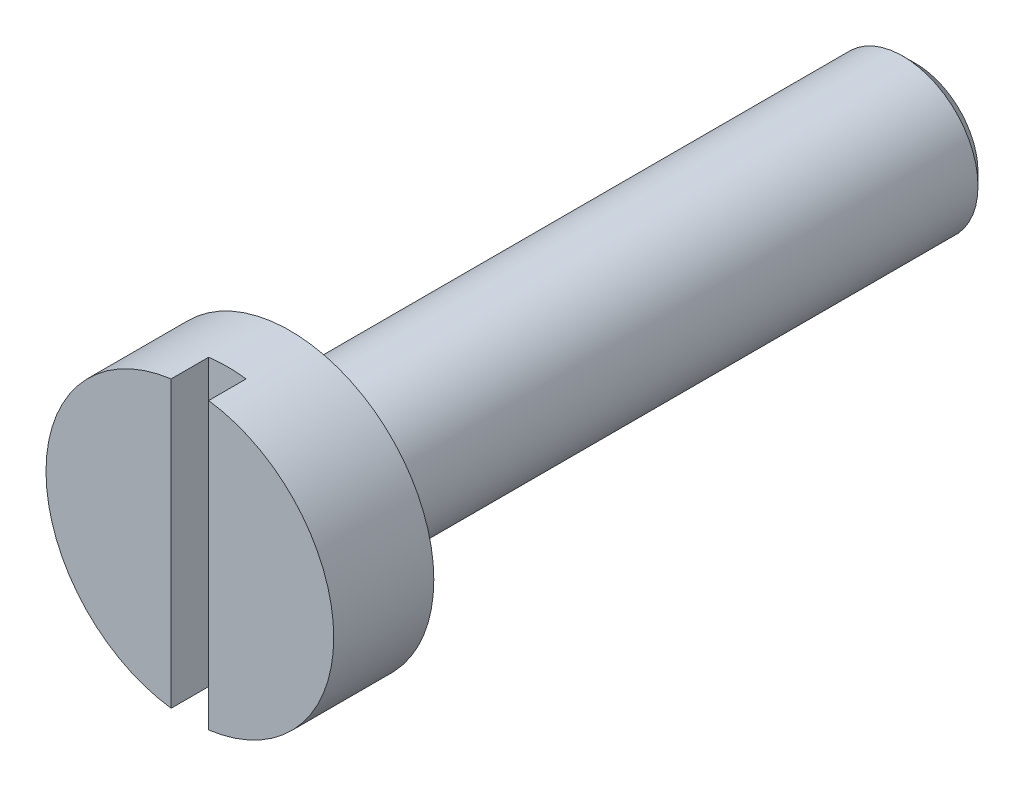
from build123d import *

# Parameters (mm, degrees)
SKETCH_1_R          = 1.15
EXTRUDE_1_DEPTH     = 0.8
SKETCH_2_R          = 0.6
EXTRUDE_2_DEPTH     = 5
CHAMFER_1_SIZE      = 0.1
SKETCH_3_W          = 0.3
SKETCH_3_H          = 2.389220408
CUT_EXTRUDE_1_DEPTH = 0.3


with BuildPart() as part:
    # Эскиз1 → Бобышка-Вытянуть1 (new body)
    with BuildSketch(Plane.XY):
        Circle(SKETCH_1_R)
    extrude(amount=EXTRUDE_1_DEPTH)

    # Эскиз2 → Бобышка-Вытянуть2 (add)
    with BuildSketch(Plane.XY):
        Circle(SKETCH_2_R)
    extrude(amount=-EXTRUDE_2_DEPTH)

    # Фаска1
    chamfer_1_edges = [part.edges().sort_by_distance(p)[0] for p in [
        (-0.6, 0, -5),
    ]]
    chamfer(chamfer_1_edges, length=CHAMFER_1_SIZE)

    # Эскиз3 → Вырез-Вытянуть1 (cut)
    with BuildSketch(Plane.XY.offset(0.8)):
        Rectangle(SKETCH_3_W, SKETCH_3_H)
    extrude(amount=-CUT_EXTRUDE_1_DEPTH, mode=Mode.SUBTRACT)


solid = part.part
